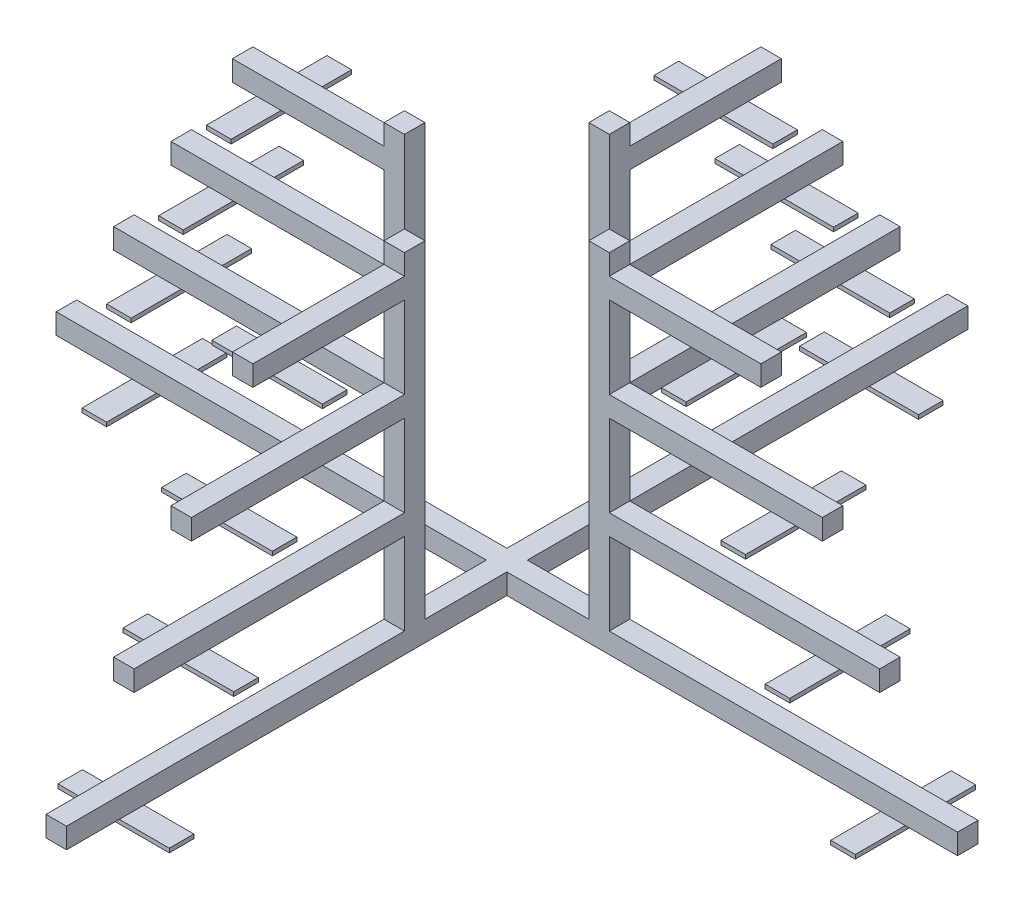
from build123d import *

# Parameters (mm, degrees)
SKETCH3_W                 = 25
SKETCH3_H                 = 25
BOSS_EXTRUDE2_DEPTH       = 550
SKETCH5_W                 = 25
SKETCH5_H                 = 25
BOSS_EXTRUDE3_DEPTH       = 550
SKETCH7_W                 = 25
SKETCH7_H                 = 25
BOSS_EXTRUDE4_DEPTH       = 400
SKETCH8_W                 = 25
SKETCH8_H                 = 25
BOSS_EXTRUDE5_DEPTH       = 400
SKETCH9_W                 = 25
SKETCH9_H                 = 25
BOSS_EXTRUDE7_DEPTH       = 260
SKETCH9_5_W               = 25
SKETCH9_5_H               = 25
BOSS_EXTRUDE8_DEPTH       = 330
SKETCH9_8_W               = 25
SKETCH9_8_H               = 25
BOSS_EXTRUDE10_DEPTH      = 185
SKETCH11_W                = 25
SKETCH11_H                = 25
BOSS_EXTRUDE11_DEPTH      = 185
SKETCH11_5_W              = 25
SKETCH11_5_H              = 25
BOSS_EXTRUDE12_DEPTH      = 260
SKETCH11_6_W              = 25
SKETCH11_6_H              = 25
BOSS_EXTRUDE13_DEPTH      = 330
SKETCH12_W                = 25
SKETCH12_H                = 25
BOSS_EXTRUDE14_DEPTH      = 185
SKETCH12_3_W              = 25
SKETCH12_3_H              = 25
BOSS_EXTRUDE15_DEPTH      = 260
SKETCH12_4_W              = 25
SKETCH12_4_H              = 25
BOSS_EXTRUDE16_DEPTH      = 330
SKETCH13_W                = 25
SKETCH13_H                = 25
BOSS_EXTRUDE17_DEPTH      = 330
SKETCH13_3_W              = 25
SKETCH13_3_H              = 25
BOSS_EXTRUDE18_DEPTH      = 260
SKETCH13_4_W              = 25
SKETCH13_4_H              = 25
BOSS_EXTRUDE19_DEPTH      = 185
BOSS_EXTRUDE21_DEPTH      = 61
BOSS_EXTRUDE21_DEPTH_BACK = 75
SKETCH15_W                = 30
SKETCH15_H                = 5
BOSS_EXTRUDE22_DEPTH      = 60
BOSS_EXTRUDE22_DEPTH_BACK = 75
SKETCH16_W                = 30
SKETCH16_H                = 5
BOSS_EXTRUDE23_DEPTH      = 61
BOSS_EXTRUDE23_DEPTH_BACK = 86
SKETCH18_W                = 30
SKETCH18_H                = 5
BOSS_EXTRUDE24_DEPTH      = 60
BOSS_EXTRUDE24_DEPTH_BACK = 85
SKETCH19_W                = 30
SKETCH19_H                = 5
BOSS_EXTRUDE27_DEPTH      = 61
BOSS_EXTRUDE27_DEPTH_BACK = 86
SKETCH20_W                = 30
SKETCH20_H                = 5


with BuildPart() as part:
    # Sketch3 → Boss-Extrude2 (new, symmetric)
    with BuildSketch(Plane.XY):
        Rectangle(SKETCH3_W, SKETCH3_H)
    extrude(amount=BOSS_EXTRUDE2_DEPTH, both=True)

    # Sketch5 → Boss-Extrude3 (add, symmetric)
    with BuildSketch(Plane(origin=(12.5, 0, 0), x_dir=(0, 0, -1), z_dir=(1, 0, 0))):
        Rectangle(SKETCH5_W, SKETCH5_H)
    extrude(amount=BOSS_EXTRUDE3_DEPTH, both=True)

    # Sketch7 → Boss-Extrude4 (add)
    with BuildSketch(Plane(origin=(0, 12.5, 0), x_dir=(1, 0, 0), z_dir=(0, 1, 0))):
        with Locations((0, 125)):
            Rectangle(SKETCH7_W, SKETCH7_H)
        with Locations((0, -125)):
            Rectangle(SKETCH7_W, SKETCH7_H)
    extrude(amount=BOSS_EXTRUDE4_DEPTH)

    # Sketch8 → Boss-Extrude5 (add)
    with BuildSketch(Plane(origin=(0, 12.5, 0), x_dir=(1, 0, 0), z_dir=(0, 1, 0))):
        with Locations((-125, 0)):
            Rectangle(SKETCH8_W, SKETCH8_H)
        with Locations((125, 0)):
            Rectangle(SKETCH8_W, SKETCH8_H)
    extrude(amount=BOSS_EXTRUDE5_DEPTH)

    # Sketch9 → Boss-Extrude7 (add)
    with BuildSketch(Plane.XY.offset(137.5)):
        with Locations((0, 250)):
            Rectangle(SKETCH9_W, SKETCH9_H)
    extrude(amount=BOSS_EXTRUDE7_DEPTH)

    # Sketch9<5> → Boss-Extrude8 (add)
    with BuildSketch(Plane.XY.offset(137.5)):
        with Locations((0, 125)):
            Rectangle(SKETCH9_5_W, SKETCH9_5_H)
    extrude(amount=BOSS_EXTRUDE8_DEPTH)

    # Sketch9<8> → Boss-Extrude10 (add)
    with BuildSketch(Plane.XY.offset(137.5)):
        with Locations((0, 375)):
            Rectangle(SKETCH9_8_W, SKETCH9_8_H)
    extrude(amount=BOSS_EXTRUDE10_DEPTH)

    # Sketch11 → Boss-Extrude11 (add)
    with BuildSketch(Plane.ZY.offset(137.5)):
        with Locations((0, 375)):
            Rectangle(SKETCH11_W, SKETCH11_H)
    extrude(amount=BOSS_EXTRUDE11_DEPTH)

    # Sketch11<5> → Boss-Extrude12 (add)
    with BuildSketch(Plane.ZY.offset(137.5)):
        with Locations((0, 250)):
            Rectangle(SKETCH11_5_W, SKETCH11_5_H)
    extrude(amount=BOSS_EXTRUDE12_DEPTH)

    # Sketch11<6> → Boss-Extrude13 (add)
    with BuildSketch(Plane.ZY.offset(137.5)):
        with Locations((0, 125)):
            Rectangle(SKETCH11_6_W, SKETCH11_6_H)
    extrude(amount=BOSS_EXTRUDE13_DEPTH)

    # Sketch12 → Boss-Extrude14 (add)
    with BuildSketch(Plane(origin=(0, 0, -137.5), x_dir=(-1, 0, 0), z_dir=(0, 0, -1))):
        with Locations((0, 375)):
            Rectangle(SKETCH12_W, SKETCH12_H)
    extrude(amount=BOSS_EXTRUDE14_DEPTH)

    # Sketch12<3> → Boss-Extrude15 (add)
    with BuildSketch(Plane(origin=(0, 0, -137.5), x_dir=(-1, 0, 0), z_dir=(0, 0, -1))):
        with Locations((0, 250)):
            Rectangle(SKETCH12_3_W, SKETCH12_3_H)
    extrude(amount=BOSS_EXTRUDE15_DEPTH)

    # Sketch12<4> → Boss-Extrude16 (add)
    with BuildSketch(Plane(origin=(0, 0, -137.5), x_dir=(-1, 0, 0), z_dir=(0, 0, -1))):
        with Locations((0, 125)):
            Rectangle(SKETCH12_4_W, SKETCH12_4_H)
    extrude(amount=BOSS_EXTRUDE16_DEPTH)

    # Sketch13 → Boss-Extrude17 (add)
    with BuildSketch(Plane(origin=(137.5, 0, 0), x_dir=(0, 0, -1), z_dir=(1, 0, 0))):
        with Locations((0, 125)):
            Rectangle(SKETCH13_W, SKETCH13_H)
    extrude(amount=BOSS_EXTRUDE17_DEPTH)

    # Sketch13<3> → Boss-Extrude18 (add)
    with BuildSketch(Plane(origin=(137.5, 0, 0), x_dir=(0, 0, -1), z_dir=(1, 0, 0))):
        with Locations((0, 250)):
            Rectangle(SKETCH13_3_W, SKETCH13_3_H)
    extrude(amount=BOSS_EXTRUDE18_DEPTH)

    # Sketch13<4> → Boss-Extrude19 (add)
    with BuildSketch(Plane(origin=(137.5, 0, 0), x_dir=(0, 0, -1), z_dir=(1, 0, 0))):
        with Locations((0, 375)):
            Rectangle(SKETCH13_4_W, SKETCH13_4_H)
    extrude(amount=BOSS_EXTRUDE19_DEPTH)

    # Sketch15 → Boss-Extrude21 (add, two sides: drawn at the far end of the back side and taken through both)
    with BuildSketch(Plane(origin=(12.5, 0, 0), x_dir=(0, 0, -1), z_dir=(1, 0, 0)).offset(-BOSS_EXTRUDE21_DEPTH_BACK)):
        with Locations((-470.519761445, -15)):
            Rectangle(SKETCH15_W, SKETCH15_H)
    extrude(amount=BOSS_EXTRUDE21_DEPTH + BOSS_EXTRUDE21_DEPTH_BACK)

    # Sketch16 → Boss-Extrude22 (add, two sides: drawn at the far end of the back side and taken through both)
    with BuildSketch(Plane(origin=(12.5, 0, 0), x_dir=(0, 0, -1), z_dir=(1, 0, 0)).offset(-BOSS_EXTRUDE22_DEPTH_BACK)):
        with Locations((-390.907976081, 110)):
            Rectangle(SKETCH16_W, SKETCH16_H)
        with Locations((-343.832488687, 235)):
            Rectangle(SKETCH16_W, SKETCH16_H)
        with Locations((-282.595194205, 360)):
            Rectangle(SKETCH16_W, SKETCH16_H)
    extrude(amount=BOSS_EXTRUDE22_DEPTH + BOSS_EXTRUDE22_DEPTH_BACK)

    # Sketch18 → Boss-Extrude23 (add, two sides: drawn at the far end of the back side and taken through both)
    with BuildSketch(Plane.XY.offset(12.5).offset(-BOSS_EXTRUDE23_DEPTH_BACK)):
        with Locations((483.727363311, -15)):
            Rectangle(SKETCH18_W, SKETCH18_H)
        with Locations((403.744811794, 110)):
            Rectangle(SKETCH18_W, SKETCH18_H)
        with Locations((349.754481778, 235)):
            Rectangle(SKETCH18_W, SKETCH18_H)
        with Locations((277.187384398, 360)):
            Rectangle(SKETCH18_W, SKETCH18_H)
    extrude(amount=BOSS_EXTRUDE23_DEPTH + BOSS_EXTRUDE23_DEPTH_BACK)

    # Sketch19 → Boss-Extrude24 (add, two sides: drawn at the far end of the back side and taken through both)
    with BuildSketch(Plane(origin=(12.5, 0, 0), x_dir=(0, 0, -1), z_dir=(1, 0, 0)).offset(-BOSS_EXTRUDE24_DEPTH_BACK)):
        with Locations((444.861975809, -15)):
            Rectangle(SKETCH19_W, SKETCH19_H)
        with Locations((409.726408873, 110)):
            Rectangle(SKETCH19_W, SKETCH19_H)
        with Locations((341.249082781, 235)):
            Rectangle(SKETCH19_W, SKETCH19_H)
        with Locations((267.100501546, 360)):
            Rectangle(SKETCH19_W, SKETCH19_H)
    extrude(amount=BOSS_EXTRUDE24_DEPTH + BOSS_EXTRUDE24_DEPTH_BACK)

    # Sketch20 → Boss-Extrude27 (add, two sides: drawn at the far end of the back side and taken through both)
    with BuildSketch(Plane(origin=(0, 0, -12.5), x_dir=(-1, 0, 0), z_dir=(0, 0, -1)).offset(-BOSS_EXTRUDE27_DEPTH_BACK)):
        with Locations((430.066631827, -15)):
            Rectangle(SKETCH20_W, SKETCH20_H)
        with Locations((400.066631827, 110)):
            Rectangle(SKETCH20_W, SKETCH20_H)
        with Locations((336.540647737, 235)):
            Rectangle(SKETCH20_W, SKETCH20_H)
        with Locations((278.06024781, 360)):
            Rectangle(SKETCH20_W, SKETCH20_H)
    extrude(amount=BOSS_EXTRUDE27_DEPTH + BOSS_EXTRUDE27_DEPTH_BACK)


solid = part.part
